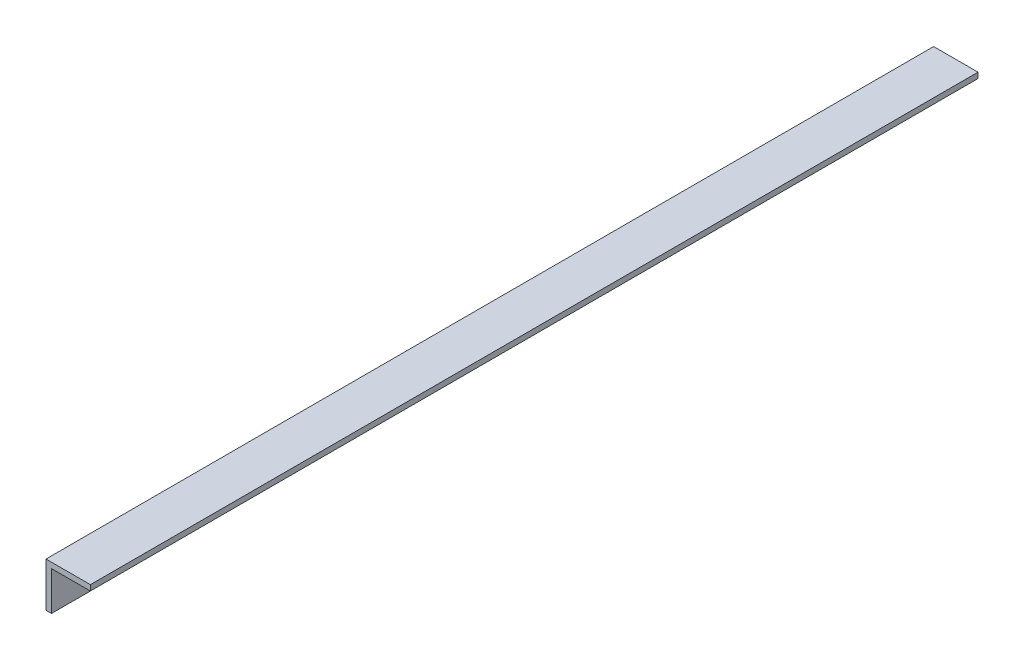
from build123d import *

# Parameters (mm, degrees)
BOSS_EXTRUDE1_DEPTH = 508


with BuildPart() as part:
    # Sketch1 → Boss-Extrude1 (new body)
    with BuildSketch(Plane.XY):
        Polygon((0, 0), (0, 25.4), (25.4, 25.4), (25.4, 22.225), (3.175, 22.225), (3.175, 0), align=None)
    extrude(amount=BOSS_EXTRUDE1_DEPTH)


solid = part.part
